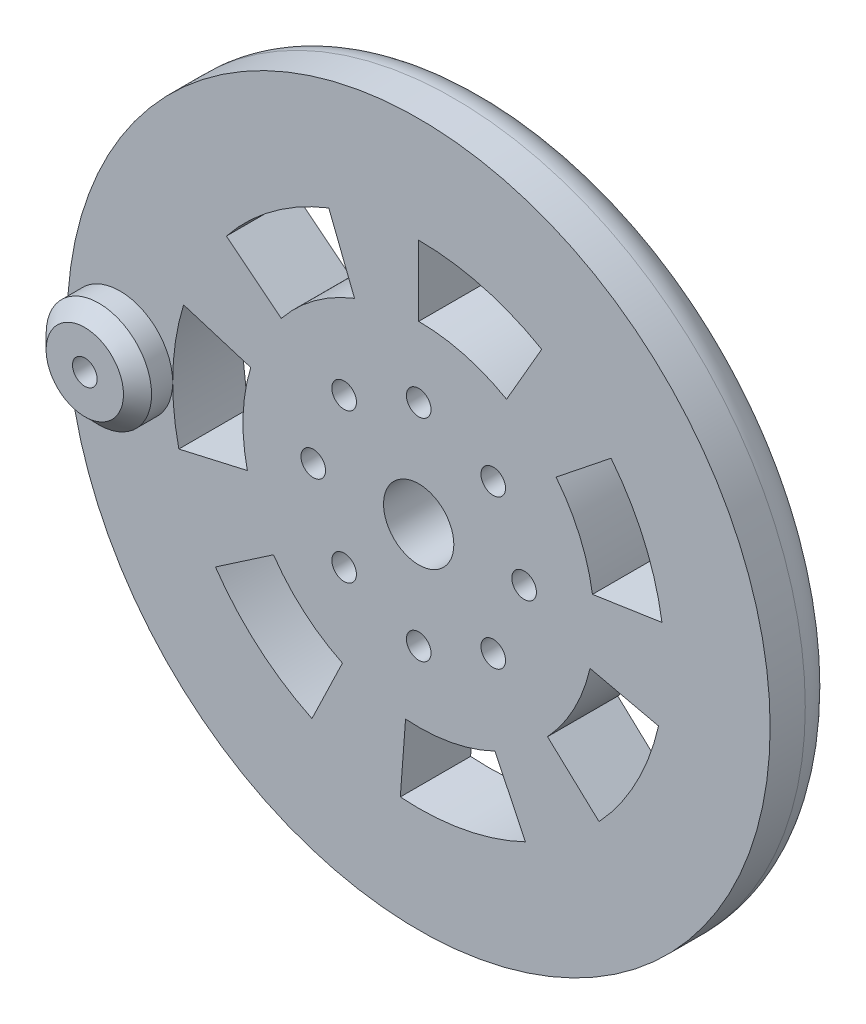
from build123d import *

# Parameters (mm, degrees)
SKETCH1_R           = 50
BOSS_EXTRUDE1_DEPTH = 10
SKETCH2_R           = 5
CUT_EXTRUDE1_DEPTH  = 72.414284285
FILLET1_R           = 5
SKETCH3_R           = 1.75
CUT_EXTRUDE2_DEPTH  = 72.414284425
SKETCH5_R           = 7.5
BOSS_EXTRUDE2_DEPTH = 5
SKETCH6_R           = 1.75
CUT_EXTRUDE3_DEPTH  = 73.284161612
SKETCH7_R           = 5.939963611
CUT_EXTRUDE4_DEPTH  = 5
CHAMFER1_SIZE       = 2
CHAMFER2_SIZE       = 2
CUT_EXTRUDE5_DEPTH  = 72.414284439
CIRPATTERN1_COUNT   = 7


with BuildPart() as part:
    # Sketch1 → Boss-Extrude1 (new body)
    with BuildSketch(Plane.XY):
        Circle(SKETCH1_R)
    extrude(amount=BOSS_EXTRUDE1_DEPTH)

    # Sketch2 → Cut-Extrude1 (cut, through all)
    with BuildSketch(Plane.XY.offset(10)):
        Circle(SKETCH2_R)
    extrude(amount=-CUT_EXTRUDE1_DEPTH, mode=Mode.SUBTRACT)

    # Fillet1
    fillet1_edges = [part.edges().sort_by_distance(p)[0] for p in [
        (-50, 0, 0),
    ]]
    fillet(fillet1_edges, radius=FILLET1_R)

    # Sketch3 → Cut-Extrude2 (cut, through all)
    with BuildSketch(Plane(origin=(0, 0, 0), x_dir=(-1, 0, 0), z_dir=(0, 0, -1))):
        with Locations((0, 15)):
            Circle(SKETCH3_R)
        with Locations((10.606601718, 10.606601718)):
            Circle(SKETCH3_R)
        with Locations((15, 0)):
            Circle(SKETCH3_R)
        with Locations((10.606601718, -10.606601718)):
            Circle(SKETCH3_R)
        with Locations((0, -15)):
            Circle(SKETCH3_R)
        with Locations((-10.606601718, -10.606601718)):
            Circle(SKETCH3_R)
        with Locations((-15, 0)):
            Circle(SKETCH3_R)
        with Locations((-10.606601718, 10.606601718)):
            Circle(SKETCH3_R)
    extrude(amount=-CUT_EXTRUDE2_DEPTH, mode=Mode.SUBTRACT)

    # Sketch5 → Boss-Extrude2 (add)
    with BuildSketch(Plane.XY.offset(10)):
        with Locations(Location((-42.5, 0, 0), (0, 0, 179.999679023))):
            Circle(SKETCH5_R)
    extrude(amount=BOSS_EXTRUDE2_DEPTH)

    # Sketch6 → Cut-Extrude3 (cut, through all)
    with BuildSketch(Plane.XY.offset(15)):
        with Locations((-42.5, 0)):
            Circle(SKETCH6_R)
    extrude(amount=-CUT_EXTRUDE3_DEPTH, mode=Mode.SUBTRACT)

    # Sketch7 → Cut-Extrude4 (cut)
    with BuildSketch(Plane(origin=(0, 0, 0), x_dir=(-1, 0, 0), z_dir=(0, 0, -1))):
        with Locations((42.5, 0)):
            Circle(SKETCH7_R)
    extrude(amount=-CUT_EXTRUDE4_DEPTH, mode=Mode.SUBTRACT)

    # Chamfer1
    chamfer1_edges = [part.edges().sort_by_distance(p)[0] for p in [
        (-36.560036389, 0, 5),
    ]]
    chamfer(chamfer1_edges, length=CHAMFER1_SIZE)

    # Chamfer2
    chamfer2_edges = [part.edges().sort_by_distance(p)[0] for p in [
        (-35, -4.2016e-05, 15),
    ]]
    chamfer(chamfer2_edges, length=CHAMFER2_SIZE)

    # Sketch8 → Cut-Extrude5 (cut, through all)
    with BuildSketch(Plane.XY.offset(10)):
        with BuildLine():
            Line((0, 35), (0, 25))
            ThreePointArc((0, 25), (6.470476128, 24.148145657), (12.5, 21.650635095))
            Line((12.5, 21.650635095), (17.5, 30.310889132))
            ThreePointArc((17.5, 30.310889132), (9.058666579, 33.80740392), (0, 35))
        make_face()
    cut_extrude5 = extrude(amount=-CUT_EXTRUDE5_DEPTH, mode=Mode.SUBTRACT)

    # CirPattern1: Cut-Extrude5 ×7 about axis
    cirpattern1_axis = Axis((0, 0, 0), (0, 0, 1))
    for i in range(1, CIRPATTERN1_COUNT):
        add(cut_extrude5.rotate(cirpattern1_axis, i * 360 / CIRPATTERN1_COUNT), mode=Mode.SUBTRACT)


solid = part.part
